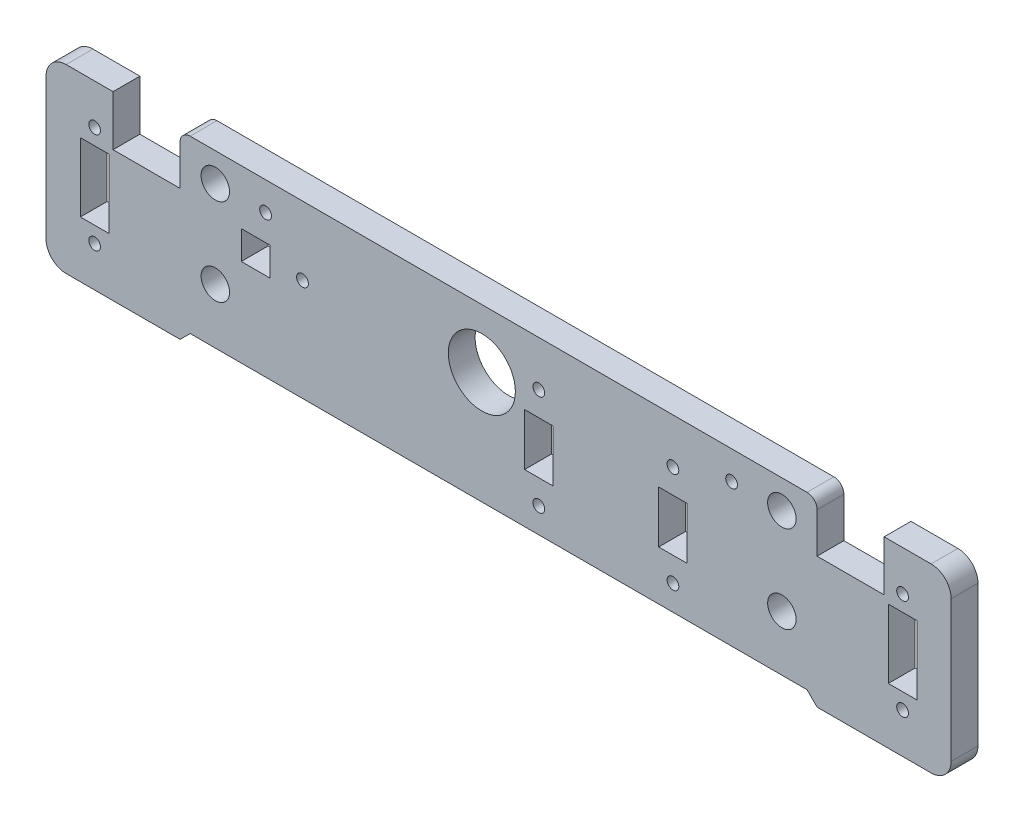
from build123d import *

# Parameters (mm, degrees)
SKETCH1_R      = 1.75
SKETCH1_R_2    = 4.25
SKETCH1_R_3    = 10
SKETCH1_W      = 8.5
SKETCH1_H      = 20.5
SKETCH1_H_2    = 15.5
SKETCH1_H_3    = 8.5
EXTRUDE1_DEPTH = 8


with BuildPart() as part:
    # Sketch1 → Extrude1 (new body)
    with BuildSketch(Plane.XY):
        with BuildLine():
            Line((234.88475828, 56.014964012), (234.88475828, 44.014964012))
            Line((234.88475828, 44.014964012), (254.88475828, 44.014964012))
            Line((254.88475828, 44.014964012), (254.88475828, 59.014964012))
            Line((254.88475828, 59.014964012), (268.88475828, 59.014964012))
            ThreePointArc((268.88475828, 59.014964012), (273.127398968, 57.257604699), (274.88475828, 53.014964012))
            Line((274.88475828, 53.014964012), (274.88475828, 11.014964012))
            ThreePointArc((274.88475828, 11.014964012), (273.127398968, 6.772323325), (268.88475828, 5.014964012))
            Line((268.88475828, 5.014964012), (234.88475828, 5.014964012))
            Line((234.88475828, 5.014964012), (231.88475828, 8.014964012))
            Line((231.88475828, 8.014964012), (47.88475828, 8.014964012))
            Line((47.88475828, 8.014964012), (44.88475828, 5.014964012))
            Line((44.88475828, 5.014964012), (10.88475828, 5.014964012))
            ThreePointArc((10.88475828, 5.014964012), (6.642117593, 6.772323325), (4.88475828, 11.014964012))
            Line((4.88475828, 11.014964012), (4.88475828, 53.014964012))
            ThreePointArc((4.88475828, 53.014964012), (6.642117593, 57.257604699), (10.88475828, 59.014964012))
            Line((10.88475828, 59.014964012), (24.88475828, 59.014964012))
            Line((24.88475828, 59.014964012), (24.88475828, 44.014964012))
            Line((24.88475828, 44.014964012), (44.88475828, 44.014964012))
            Line((44.88475828, 44.014964012), (44.88475828, 56.014964012))
            ThreePointArc((44.88475828, 56.014964012), (45.763437937, 58.136284356), (47.88475828, 59.014964012))
            Line((47.88475828, 59.014964012), (231.88475828, 59.014964012))
            ThreePointArc((231.88475828, 59.014964012), (234.006078624, 58.136284356), (234.88475828, 56.014964012))
        make_face()
        with Locations((260.38475828, 47.014964012)):
            Circle(SKETCH1_R, mode=Mode.SUBTRACT)
        with Locations((260.38475828, 17.014964012)):
            Circle(SKETCH1_R, mode=Mode.SUBTRACT)
        with Locations((19.38475828, 47.014964012)):
            Circle(SKETCH1_R, mode=Mode.SUBTRACT)
        with Locations((19.38475828, 17.014964012)):
            Circle(SKETCH1_R, mode=Mode.SUBTRACT)
        with Locations((224.38475828, 50.514964012)):
            Circle(SKETCH1_R_2, mode=Mode.SUBTRACT)
        with Locations((224.38475828, 24.514964012)):
            Circle(SKETCH1_R_2, mode=Mode.SUBTRACT)
        with Locations((55.38475828, 50.514964012)):
            Circle(SKETCH1_R_2, mode=Mode.SUBTRACT)
        with Locations((55.38475828, 24.514964012)):
            Circle(SKETCH1_R_2, mode=Mode.SUBTRACT)
        with Locations((191.88475828, 15.514964012)):
            Circle(SKETCH1_R, mode=Mode.SUBTRACT)
        with Locations((191.88475828, 45.514964012)):
            Circle(SKETCH1_R, mode=Mode.SUBTRACT)
        with Locations((151.88475828, 15.514964012)):
            Circle(SKETCH1_R, mode=Mode.SUBTRACT)
        with Locations((151.88475828, 45.514964012)):
            Circle(SKETCH1_R, mode=Mode.SUBTRACT)
        with Locations((81.38475828, 38.514964012)):
            Circle(SKETCH1_R, mode=Mode.SUBTRACT)
        with Locations((70.38475828, 50.514964012)):
            Circle(SKETCH1_R, mode=Mode.SUBTRACT)
        with Locations((134.88475828, 41.514964012)):
            Circle(SKETCH1_R_3, mode=Mode.SUBTRACT)
        with Locations(Location((209.38475828, 50.514964012, 0), (0, 0, 180))):
            Circle(SKETCH1_R, mode=Mode.SUBTRACT)
        with Locations((260.38475828, 32.014964012)):
            Rectangle(SKETCH1_W, SKETCH1_H, mode=Mode.SUBTRACT)
        with Locations((19.38475828, 32.014964012)):
            Rectangle(SKETCH1_W, SKETCH1_H, mode=Mode.SUBTRACT)
        with Locations((191.88475828, 30.514964012)):
            Rectangle(SKETCH1_W, SKETCH1_H_2, mode=Mode.SUBTRACT)
        with Locations((151.88475828, 30.514964012)):
            Rectangle(SKETCH1_W, SKETCH1_H_2, mode=Mode.SUBTRACT)
        with Locations((67.38475828, 38.514964012)):
            Rectangle(SKETCH1_W, SKETCH1_H_3, mode=Mode.SUBTRACT)
    extrude(amount=EXTRUDE1_DEPTH)


solid = part.part
